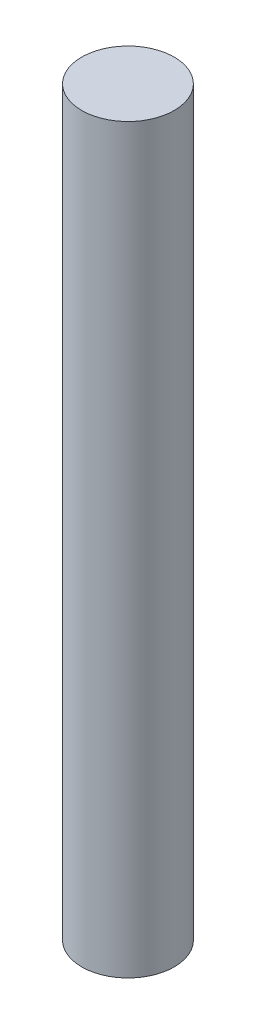
from build123d import *

# Parameters (mm, degrees)
SKETCH_2_R      = 4.99
EXTRUDE_1_DEPTH = 80


with BuildPart() as part:
    # 草图2 → 凸台-拉伸1 (new body)
    with BuildSketch(Plane(origin=(0, 0, 0), x_dir=(1, 0, 0), z_dir=(0, 1, 0))):
        with Locations(Location((0, 0, 0), (0, 0, 270))):
            Circle(SKETCH_2_R)
    extrude(amount=EXTRUDE_1_DEPTH)


solid = part.part
